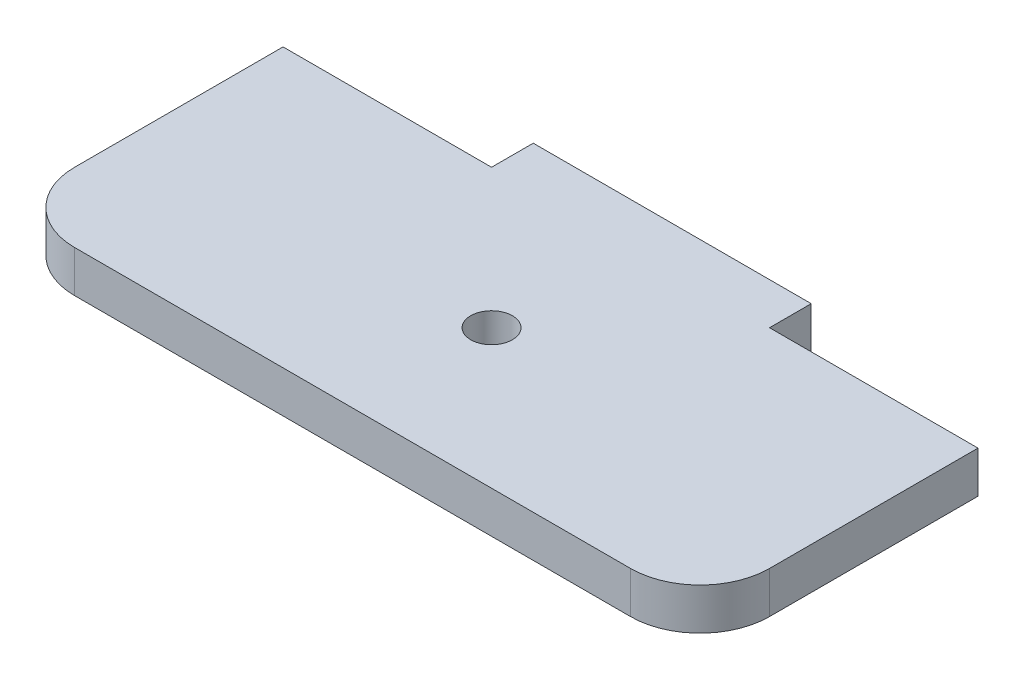
from build123d import *

# Parameters (mm, degrees)
CROQUIS1_R              = 1.5
SALIENTE_EXTRUIR1_DEPTH = 3
CROQUIS2_W              = 20
CROQUIS2_H              = 3
SALIENTE_EXTRUIR2_DEPTH = 3


with BuildPart() as part:
    # Croquis1 → Saliente-Extruir1 (new body)
    with BuildSketch(Plane(origin=(0, 0, 0), x_dir=(1, 0, 0), z_dir=(0, 1, 0))):
        with BuildLine():
            Line((20, -10), (-20, -10))
            ThreePointArc((-20, -10), (-23.535533906, -8.535533906), (-25, -5))
            Line((-25, -5), (-25, 10))
            Line((-25, 10), (25, 10))
            Line((25, 10), (25, -5))
            ThreePointArc((25, -5), (23.535533906, -8.535533906), (20, -10))
        make_face()
        with Locations(Location((0, 0, 0), (0, 0, 270))):
            Circle(CROQUIS1_R, mode=Mode.SUBTRACT)
    extrude(amount=SALIENTE_EXTRUIR1_DEPTH)

    # Croquis2 → Saliente-Extruir2 (add)
    with BuildSketch(Plane(origin=(0, 0, -10), x_dir=(-1, 0, 0), z_dir=(0, 0, -1))):
        with Locations((0, 1.5)):
            Rectangle(CROQUIS2_W, CROQUIS2_H)
    extrude(amount=SALIENTE_EXTRUIR2_DEPTH)


solid = part.part
